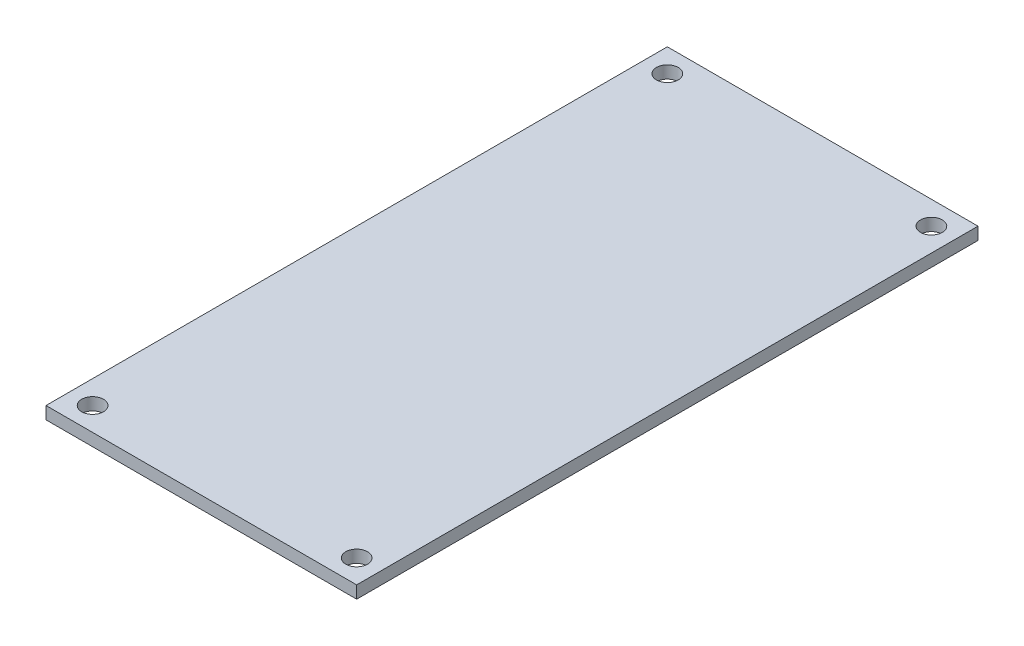
from build123d import *

# Parameters (mm, degrees)
SKETCH_1_W      = 50
SKETCH_1_H      = 100
SKETCH_1_R      = 1.75
EXTRUDE_1_DEPTH = 2


with BuildPart() as part:
    # 스케치1 → 보스-돌출1 (new body)
    with BuildSketch(Plane(origin=(0, 0, 0), x_dir=(1, 0, 0), z_dir=(0, 1, 0))):
        Rectangle(SKETCH_1_W, SKETCH_1_H)
        with Locations(Location((-21.25, 46.25, 0), (0, 0, 270))):
            Circle(SKETCH_1_R, mode=Mode.SUBTRACT)
        with Locations(Location((21.25, 46.25, 0), (0, 0, 90))):
            Circle(SKETCH_1_R, mode=Mode.SUBTRACT)
        with Locations(Location((21.25, -46.25, 0), (0, 0, 270))):
            Circle(SKETCH_1_R, mode=Mode.SUBTRACT)
        with Locations(Location((-21.25, -46.25, 0), (0, 0, 90))):
            Circle(SKETCH_1_R, mode=Mode.SUBTRACT)
    extrude(amount=EXTRUDE_1_DEPTH)


solid = part.part
